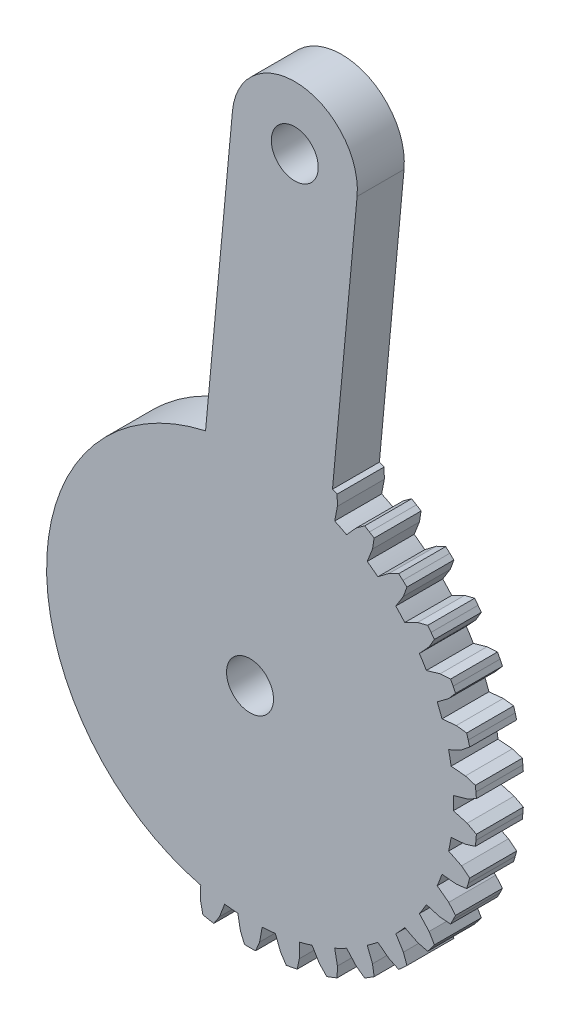
from build123d import *

# Parameters (mm, degrees)
BOSS_EXTRUDE1_DEPTH = 3
SKETCH2_R           = 1.5
CUT_EXTRUDE1_DEPTH  = 7
BOSS_EXTRUDE4_START = -3
SKETCH4_R           = 1.5
BOSS_EXTRUDE4_DEPTH = 3


with BuildPart() as part:
    # Sketch1 → Boss-Extrude1 (new body)
    with BuildSketch(Plane.XY):
        with BuildLine():
            Line((-0.612376666, 13.878994029), (-0.776800125, 12.976770845))
            ThreePointArc((-0.776800125, 12.976770845), (-12.944544292, 1.199488673), (-3.148049012, -12.613080013))
            Line((-3.148049012, -12.613080013), (-3.15220825, -13.530153864))
            Line((-3.15220825, -13.530153864), (-3.012443123, -14.183623882))
            Line((-3.012443123, -14.183623882), (-2.664368008, -14.253109945))
            Line((-2.664368008, -14.253109945), (-2.314696368, -14.314055356))
            Line((-2.314696368, -14.314055356), (-1.948308671, -13.755201698))
            Line((-1.948308671, -13.755201698), (-1.620901759, -12.89855331))
            ThreePointArc((-1.620901759, -12.89855331), (-1.199488673, -12.944544292), (-0.776800125, -12.976770845))
            Line((-0.776800125, -12.976770845), (-0.612376666, -13.878994029))
            Line((-0.612376666, -13.878994029), (-0.354916505, -14.495655703))
            Line((-0.354916505, -14.495655703), (0, -14.5))
            Line((0, -14.5), (0.354916505, -14.495655703))
            Line((0.354916505, -14.495655703), (0.612376666, -13.878994029))
            Line((0.612376666, -13.878994029), (0.776800125, -12.976770845))
            ThreePointArc((0.776800125, -12.976770845), (1.199488673, -12.944544292), (1.620901759, -12.89855331))
            Line((1.620901759, -12.89855331), (1.948308671, -13.755201698))
            Line((1.948308671, -13.755201698), (2.314696368, -14.314055356))
            Line((2.314696368, -14.314055356), (2.664368008, -14.253109945))
            Line((2.664368008, -14.253109945), (3.012443123, -14.183623882))
            Line((3.012443123, -14.183623882), (3.15220825, -13.530153864))
            Line((3.15220825, -13.530153864), (3.148049012, -12.613080013))
            ThreePointArc((3.148049012, -12.613080013), (3.557618871, -12.503733361), (3.963405777, -12.381091012))
            Line((3.963405777, -12.381091012), (4.442646693, -13.162992471))
            Line((4.442646693, -13.162992471), (4.905485034, -13.64500702))
            Line((4.905485034, -13.64500702), (5.23800416, -13.520847326))
            Line((5.23800416, -13.520847326), (5.567384604, -13.388585761))
            Line((5.567384604, -13.388585761), (5.584695163, -12.720560537))
            Line((5.584695163, -12.720560537), (5.412094866, -11.819865869))
            ThreePointArc((5.412094866, -11.819865869), (5.794598625, -11.637122788), (6.170940766, -11.442005509))
            Line((6.170940766, -11.442005509), (6.78569571, -12.122533323))
            Line((6.78569571, -12.122533323), (7.32922329, -12.511294336))
            Line((7.32922329, -12.511294336), (7.633266362, -12.328148468))
            Line((7.633266362, -12.328148468), (7.932735479, -12.137615409))
            Line((7.932735479, -12.137615409), (7.82700198, -11.477783777))
            Line((7.82700198, -11.477783777), (7.491838321, -10.624140369))
            ThreePointArc((7.491838321, -10.624140369), (7.834250273, -10.374223955), (8.168331768, -10.113276232))
            Line((8.168331768, -10.113276232), (8.897665999, -10.669255841))
            Line((8.897665999, -10.669255841), (9.503373637, -10.951524529))
            Line((9.503373637, -10.951524529), (9.768586833, -10.7156293))
            Line((9.768586833, -10.7156293), (10.027946562, -10.473313122))
            Line((10.027946562, -10.473313122), (9.802769632, -9.844144857))
            Line((9.802769632, -9.844144857), (9.316456206, -9.066622511))
            ThreePointArc((9.316456206, -9.066622511), (9.607115924, -8.758043367), (9.887560028, -8.440151462))
            Line((9.887560028, -8.440151462), (10.706636943, -8.852649649))
            Line((10.706636943, -8.852649649), (11.353897993, -9.01881369))
            Line((11.353897993, -9.01881369), (11.571249796, -8.738202227))
            Line((11.571249796, -8.738202227), (11.781667951, -8.452354718))
            Line((11.781667951, -8.452354718), (11.444715722, -7.875275391))
            Line((11.444715722, -7.875275391), (10.82381335, -7.200351698))
            ThreePointArc((10.82381335, -7.200351698), (11.052822764, -6.843618117), (11.27007929, -6.479607457))
            Line((11.27007929, -6.479607457), (12.151006207, -6.73457709))
            Line((12.151006207, -6.73457709), (12.81777897, -6.778977966))
            Line((12.81777897, -6.778977966), (12.979867725, -6.463206159))
            Line((12.979867725, -6.463206159), (13.134178769, -6.143561512))
            Line((13.134178769, -6.143561512), (12.696925744, -5.638222867))
            Line((12.696925744, -5.638222867), (11.962578511, -5.088881543))
            ThreePointArc((11.962578511, -5.088881543), (12.122138982, -4.69614166), (12.268809519, -4.298408191))
            Line((12.268809519, -4.298408191), (13.181587529, -4.387166586))
            Line((13.181587529, -4.387166586), (13.845165858, -4.308292279))
            Line((13.845165858, -4.308292279), (13.946471826, -3.968113356))
            Line((13.946471826, -3.968113356), (14.039420882, -3.625556687))
            Line((14.039420882, -3.625556687), (13.516757188, -3.209167425))
            Line((13.516757188, -3.209167425), (12.693972409, -2.804115631))
            ThreePointArc((12.693972409, -2.804115631), (12.778650296, -2.388743732), (12.849740155, -1.97083179))
            Line((12.849740155, -1.97083179), (13.763285697, -1.890356385))
            Line((13.763285697, -1.890356385), (14.401072228, -1.690892865))
            Line((14.401072228, -1.690892865), (14.438145556, -1.337891212))
            Line((14.438145556, -1.337891212), (14.466567355, -0.984087877))
            Line((14.466567355, -0.984087877), (13.876291677, -0.670827635))
            Line((13.876291677, -0.670827635), (12.993088302, -0.423858924))
            ThreePointArc((12.993088302, -0.423858924), (13, 0), (12.993088302, 0.423858924))
            Line((12.993088302, 0.423858924), (13.876291677, 0.670827635))
            Line((13.876291677, 0.670827635), (14.466567355, 0.984087877))
            Line((14.466567355, 0.984087877), (14.438145556, 1.337891212))
            Line((14.438145556, 1.337891212), (14.401072228, 1.690892865))
            Line((14.401072228, 1.690892865), (13.763285697, 1.890356385))
            Line((13.763285697, 1.890356385), (12.849740155, 1.97083179))
            ThreePointArc((12.849740155, 1.97083179), (12.778650296, 2.388743732), (12.693972409, 2.804115631))
            Line((12.693972409, 2.804115631), (13.516757188, 3.209167425))
            Line((13.516757188, 3.209167425), (14.039420882, 3.625556687))
            Line((14.039420882, 3.625556687), (13.946471826, 3.968113356))
            Line((13.946471826, 3.968113356), (13.845165858, 4.308292279))
            Line((13.845165858, 4.308292279), (13.181587529, 4.387166586))
            Line((13.181587529, 4.387166586), (12.268809519, 4.298408191))
            ThreePointArc((12.268809519, 4.298408191), (12.122138982, 4.69614166), (11.962578511, 5.088881543))
            Line((11.962578511, 5.088881543), (12.696925744, 5.638222867))
            Line((12.696925744, 5.638222867), (13.134178769, 6.143561512))
            Line((13.134178769, 6.143561512), (12.979867725, 6.463206159))
            Line((12.979867725, 6.463206159), (12.81777897, 6.778977966))
            Line((12.81777897, 6.778977966), (12.151006207, 6.73457709))
            Line((12.151006207, 6.73457709), (11.27007929, 6.479607457))
            ThreePointArc((11.27007929, 6.479607457), (11.052822764, 6.843618117), (10.82381335, 7.200351698))
            Line((10.82381335, 7.200351698), (11.444715722, 7.875275391))
            Line((11.444715722, 7.875275391), (11.781667951, 8.452354718))
            Line((11.781667951, 8.452354718), (11.571249796, 8.738202228))
            Line((11.571249796, 8.738202228), (11.353897993, 9.01881369))
            Line((11.353897993, 9.01881369), (10.706636943, 8.852649649))
            Line((10.706636943, 8.852649649), (9.887560028, 8.440151462))
            ThreePointArc((9.887560028, 8.440151462), (9.607115924, 8.758043367), (9.316456206, 9.066622511))
            Line((9.316456206, 9.066622511), (9.802769632, 9.844144857))
            Line((9.802769632, 9.844144857), (10.027946562, 10.473313122))
            Line((10.027946562, 10.473313122), (9.768586833, 10.7156293))
            Line((9.768586833, 10.7156293), (9.503373637, 10.951524529))
            Line((9.503373637, 10.951524529), (8.897665999, 10.669255841))
            Line((8.897665999, 10.669255841), (8.168331768, 10.113276232))
            ThreePointArc((8.168331768, 10.113276232), (7.834250273, 10.374223955), (7.491838321, 10.624140369))
            Line((7.491838321, 10.624140369), (7.82700198, 11.477783777))
            Line((7.82700198, 11.477783777), (7.932735479, 12.137615409))
            Line((7.932735479, 12.137615409), (7.633266362, 12.328148468))
            Line((7.633266362, 12.328148468), (7.32922329, 12.511294336))
            Line((7.32922329, 12.511294336), (6.78569571, 12.122533323))
            Line((6.78569571, 12.122533323), (6.170940766, 11.442005509))
            ThreePointArc((6.170940766, 11.442005509), (5.794598625, 11.637122788), (5.412094866, 11.819865869))
            Line((5.412094866, 11.819865869), (5.584695163, 12.720560537))
            Line((5.584695163, 12.720560537), (5.567384604, 13.388585761))
            Line((5.567384604, 13.388585761), (5.23800416, 13.520847326))
            Line((5.23800416, 13.520847326), (4.905485034, 13.64500702))
            Line((4.905485034, 13.64500702), (4.442646693, 13.162992471))
            Line((4.442646693, 13.162992471), (3.963405777, 12.381091012))
            ThreePointArc((3.963405777, 12.381091012), (3.557618871, 12.503733361), (3.148049012, 12.613080013))
            Line((3.148049012, 12.613080013), (3.15220825, 13.530153864))
            Line((3.15220825, 13.530153864), (3.012443123, 14.183623882))
            Line((3.012443123, 14.183623882), (2.664368008, 14.253109945))
            Line((2.664368008, 14.253109945), (2.314696368, 14.314055356))
            Line((2.314696368, 14.314055356), (1.948308671, 13.755201698))
            Line((1.948308671, 13.755201698), (1.620901759, 12.89855331))
            ThreePointArc((1.620901759, 12.89855331), (1.199488673, 12.944544292), (0.776800125, 12.976770845))
            Line((0.776800125, 12.976770845), (0.612376666, 13.878994029))
            Line((0.612376666, 13.878994029), (0.354916505, 14.495655703))
            Line((0.354916505, 14.495655703), (0, 14.5))
            Line((0, 14.5), (-0.354916505, 14.495655703))
            Line((-0.354916505, 14.495655703), (-0.612376666, 13.878994029))
        make_face()
    extrude(amount=BOSS_EXTRUDE1_DEPTH)

    # Sketch2 → Cut-Extrude1 (cut)
    with BuildSketch(Plane.XY.offset(3)):
        Circle(SKETCH2_R)
    extrude(amount=-CUT_EXTRUDE1_DEPTH, mode=Mode.SUBTRACT)

    # Sketch4 → Boss-Extrude4 (add)
    with BuildSketch(Plane.XY.offset(3).offset(BOSS_EXTRUDE4_START)):
        with BuildLine():
            Line((-1.122617562, 31.236832903), (-2.841640129, 12.68562499))
            ThreePointArc((-2.841640129, 12.68562499), (-1.815067202, 12.872666043), (-0.776800125, 12.976770845))
            Line((-0.776800125, 12.976770845), (-0.612376666, 13.878994029))
            Line((-0.612376666, 13.878994029), (-0.354916505, 14.495655703))
            Line((-0.354916505, 14.495655703), (0, 14.5))
            Line((0, 14.5), (0.354916505, 14.495655703))
            Line((0.354916505, 14.495655703), (0.612376666, 13.878994029))
            Line((0.612376666, 13.878994029), (0.776800125, 12.976770845))
            ThreePointArc((0.776800125, 12.976770845), (1.199488673, 12.944544292), (1.620901759, 12.89855331))
            Line((1.620901759, 12.89855331), (1.948308671, 13.755201698))
            Line((1.948308671, 13.755201698), (2.314696368, 14.314055356))
            Line((2.314696368, 14.314055356), (2.664368008, 14.253109945))
            Line((2.664368008, 14.253109945), (3.012443123, 14.183623882))
            Line((3.012443123, 14.183623882), (3.15220825, 13.530153864))
            Line((3.15220825, 13.530153864), (3.148049012, 12.613080013))
            ThreePointArc((3.148049012, 12.613080013), (3.557618871, 12.503733361), (3.963405777, 12.381091012))
            Line((3.963405777, 12.381091012), (4.442646693, 13.162992471))
            Line((4.442646693, 13.162992471), (4.905485034, 13.64500702))
            Line((4.905485034, 13.64500702), (5.23800416, 13.520847326))
            Line((5.23800416, 13.520847326), (5.268878609, 13.508449799))
            Line((5.268878609, 13.508449799), (6.843255849, 30.498686027))
            ThreePointArc((6.843255849, 30.498686027), (3.229392581, 34.85069617), (-1.122617562, 31.236832903))
        make_face()
        with Locations((2.860319143, 30.867759465)):
            Circle(SKETCH4_R, mode=Mode.SUBTRACT)
    extrude(amount=BOSS_EXTRUDE4_DEPTH)


solid = part.part
